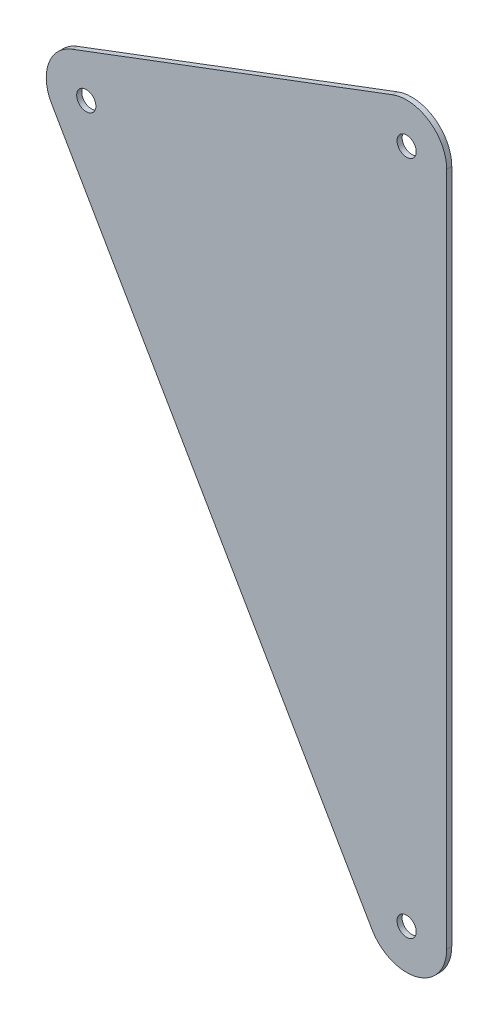
from build123d import *

# Parameters (mm, degrees)
SKETCH1_R           = 3
BOSS_EXTRUDE1_DEPTH = 1.5875


with BuildPart() as part:
    # Sketch1 → Boss-Extrude1 (new body)
    with BuildSketch(Plane.XY):
        with BuildLine():
            Line((-110.825317547, 166.955080757), (-10.825317547, -6.25))
            ThreePointArc((-10.825317547, -6.25), (3.235238064, -12.074072829), (12.5, 0))
            Line((12.5, 0), (12.5, 210.889668604))
            ThreePointArc((12.5, 210.889668604), (7.111624908, 221.169493076), (-4.407966588, 222.586669526))
            Line((-4.407966588, 222.586669526), (-104.407966588, 184.902081679))
            ThreePointArc((-104.407966588, 184.902081679), (-111.770171915, 177.413768568), (-110.825317547, 166.955080757))
        make_face()
        with Locations((-100, 173.205080757)):
            Circle(SKETCH1_R, mode=Mode.SUBTRACT)
        with Locations((0, 210.889668604)):
            Circle(SKETCH1_R, mode=Mode.SUBTRACT)
        Circle(SKETCH1_R, mode=Mode.SUBTRACT)
    extrude(amount=BOSS_EXTRUDE1_DEPTH)


solid = part.part
